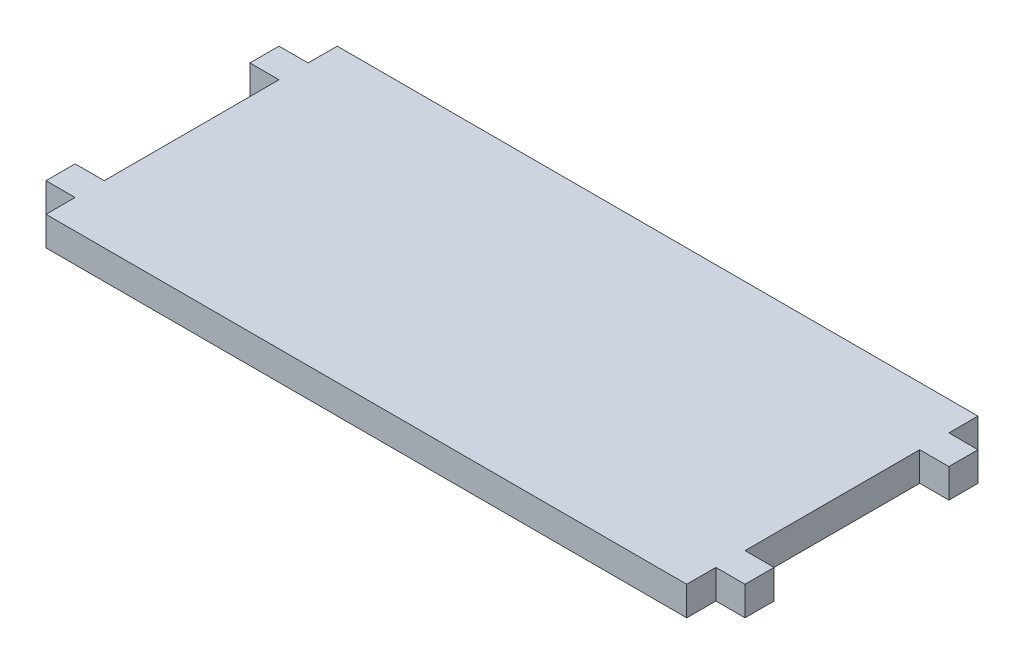
from build123d import *

# Parameters (mm, degrees)
SKETCH2_W           = 110
SKETCH2_H           = 50
BOSS_EXTRUDE1_DEPTH = 5
SKETCH3_W           = 5
SKETCH3_H           = 5
BOSS_EXTRUDE2_DEPTH = 5
SKETCH4_W           = 5
SKETCH4_H           = 5
BOSS_EXTRUDE3_DEPTH = 5


with BuildPart() as part:
    # Sketch2 → Boss-Extrude1 (new body)
    with BuildSketch(Plane(origin=(0, 0, 0), x_dir=(1, 0, 0), z_dir=(0, 1, 0))):
        with Locations((-36.942060086, 18.524678112)):
            Rectangle(SKETCH2_W, SKETCH2_H)
    extrude(amount=BOSS_EXTRUDE1_DEPTH)

    # Sketch3 → Boss-Extrude2 (add)
    with BuildSketch(Plane.ZY.offset(91.942060086)):
        with Locations((-36.024678112, 2.5)):
            Rectangle(SKETCH3_W, SKETCH3_H)
        with Locations((-1.024678112, 2.5)):
            Rectangle(SKETCH3_W, SKETCH3_H)
    extrude(amount=BOSS_EXTRUDE2_DEPTH)

    # Sketch4 → Boss-Extrude3 (add)
    with BuildSketch(Plane(origin=(18.057939914, 0, 0), x_dir=(0, 0, -1), z_dir=(1, 0, 0))):
        with Locations((36.024678112, 2.5)):
            Rectangle(SKETCH4_W, SKETCH4_H)
        with Locations((1.024678112, 2.5)):
            Rectangle(SKETCH4_W, SKETCH4_H)
    extrude(amount=BOSS_EXTRUDE3_DEPTH)


solid = part.part
